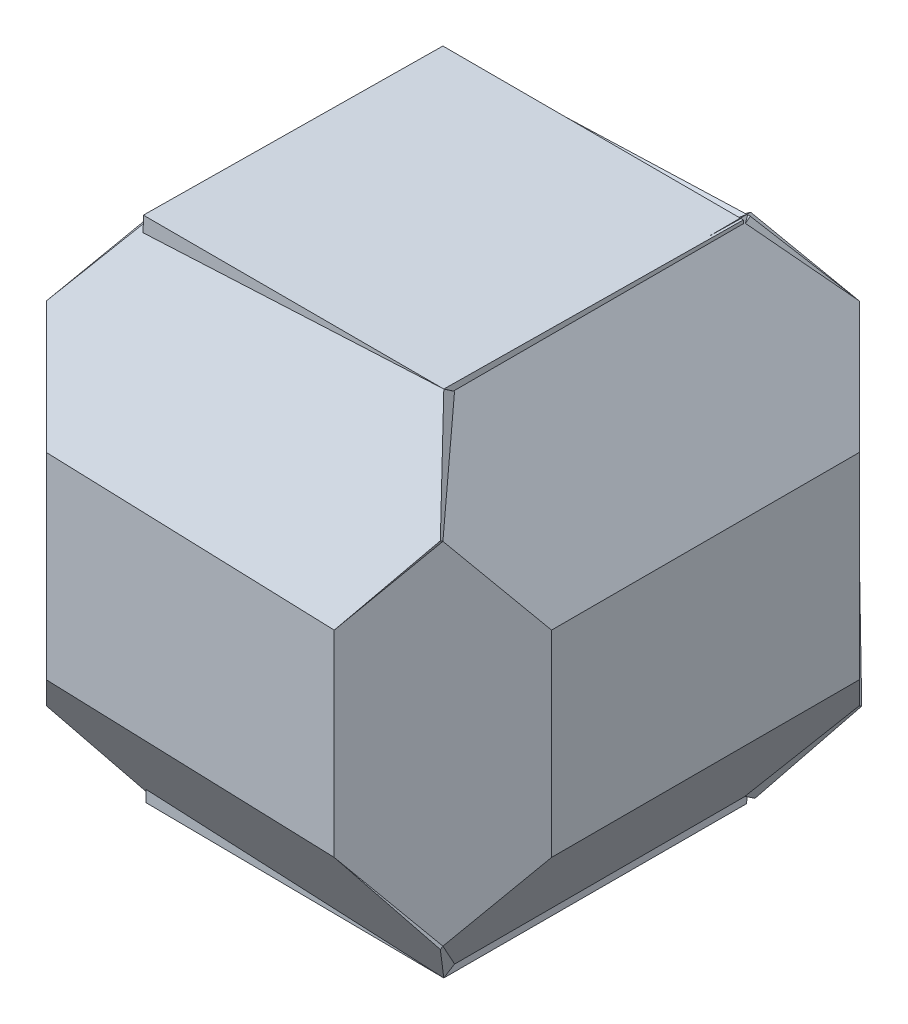
from build123d import *

# Parameters (mm, degrees)
SKETCH1_W            = 50
SKETCH1_H            = 50
BOSS_EXTRUDE1_DEPTH  = 50
BOSS_EXTRUDE2_DEPTH  = 82
BOSS_EXTRUDE3_DEPTH  = 82
SKETCH10_W           = 43.89696962
SKETCH10_H           = 28.079689784
BOSS_EXTRUDE4_DEPTH  = 67
SKETCH11_W           = 41.068542494
SKETCH11_H           = 28.079689784
BOSS_EXTRUDE5_DEPTH  = 69
SKETCH12_W           = 42.506288502
SKETCH12_H           = 28.079689784
BOSS_EXTRUDE6_DEPTH  = 69
SKETCH13_W           = 42.506288502
SKETCH13_H           = 28.079689784
BOSS_EXTRUDE7_DEPTH  = 69
BOSS_EXTRUDE11_DEPTH = 35
BOSS_EXTRUDE12_DEPTH = 20
BOSS_EXTRUDE13_DEPTH = 35
BOSS_EXTRUDE16_DEPTH = 30
BOSS_EXTRUDE17_DEPTH = 30
BOSS_EXTRUDE18_DEPTH = 30
BOSS_EXTRUDE19_DEPTH = 30
BOSS_EXTRUDE20_DEPTH = 30
SKETCH30_W           = 42.854917171
SKETCH30_H           = 42.727525514
BOSS_EXTRUDE21_DEPTH = 40
SKETCH33_W           = 42.490664677
SKETCH33_H           = 43.20817588
BOSS_EXTRUDE23_DEPTH = 40


with BuildPart() as part:
    # Sketch1 → Boss-Extrude1 (new body)
    with BuildSketch(Plane.XY):
        with Locations((25, 25)):
            Rectangle(SKETCH1_W, SKETCH1_H)
    extrude(amount=BOSS_EXTRUDE1_DEPTH)

    # Sketch7 → Boss-Extrude2 (add)
    with BuildSketch(Plane(origin=(-3.284271247, 0, -3.284271247), x_dir=(-0.7071067811865477, 0, 0.7071067811865475), z_dir=(-0.7071067811865475, 0, -0.7071067811865477))):
        Polygon((0, 50), (-10.960155108, 39.039844892), (-10.960155108, 10.960155108), (0, 0), (10.960155108, 10.960155108), (10.960155108, 39.039844892), align=None)
    extrude(amount=-BOSS_EXTRUDE2_DEPTH)

    # Sketch9 → Boss-Extrude3 (add)
    with BuildSketch(Plane(origin=(-28.284271247, 0, 28.284271247), x_dir=(0.7071067811865477, 0, 0.7071067811865475), z_dir=(-0.7071067811865475, 0, 0.7071067811865477))):
        Polygon((46.315494168, 39.039844892), (46.315494168, 10.960155108), (35.355339059, 0), (35.355339059, 50), align=None)
        Polygon((35.355339059, 0), (35.355339059, 25), (24.395183951, 25), (24.395183951, 10.960155108), align=None)
        Polygon((35.355339059, 25), (35.355339059, 50), (24.395183951, 39.039844892), (24.395183951, 25), align=None)
    extrude(amount=-BOSS_EXTRUDE3_DEPTH)

    # Sketch10 → Boss-Extrude4 (add)
    with BuildSketch(Plane(origin=(62.44848481, 0, 0), x_dir=(0, 0, -1), z_dir=(1, 0, 0))):
        with Locations((-25, 25)):
            Rectangle(SKETCH10_W, SKETCH10_H)
    extrude(amount=-BOSS_EXTRUDE4_DEPTH)

    # Sketch11 → Boss-Extrude5 (add)
    with BuildSketch(Plane.ZY.offset(11.034271247)):
        with Locations((25, 25)):
            Rectangle(SKETCH11_W, SKETCH11_H)
    extrude(amount=-BOSS_EXTRUDE5_DEPTH)

    # Sketch12 → Boss-Extrude6 (add)
    with BuildSketch(Plane(origin=(-0.361971288, 0, -10.873561362), x_dir=(0.9994463773330298, 0, -0.03327069034275125), z_dir=(0.03327069034275125, 0, 0.9994463773330298))):
        with Locations((26.083518497, 25)):
            Rectangle(SKETCH12_W, SKETCH12_H)
    extrude(amount=BOSS_EXTRUDE6_DEPTH)

    # Sketch13 → Boss-Extrude7 (add)
    with BuildSketch(Plane(origin=(-2.024584835, 0, 60.81821442), x_dir=(-0.9994463773330297, 0, -0.033270690342753886), z_dir=(0.033270690342753886, 0, -0.9994463773330298))):
        with Locations((-27.747053014, 25)):
            Rectangle(SKETCH13_W, SKETCH13_H)
    extrude(amount=BOSS_EXTRUDE7_DEPTH)

    # Sketch18 → Boss-Extrude11 (add)
    with BuildSketch(Plane(origin=(-1.210472992, -24.856180746, 36.362420912), x_dir=(-0.9996225841221649, 0.015502846079432883, -0.022679309433112364), z_dir=(0.02747160921616073, 0.5641094752488854, -0.8252428797763128))):
        Polygon((-48.177140619, 44.289287441), (-55.918364596, 30.867583479), (2.074581236, 30.069511003), (-5.678344842, 43.491214965), align=None)
        Polygon((-6.044745692, 16.86623375), (-48.549408926, 17.237940115), (-55.918364596, 30.867583479), (2.074581236, 30.069511003), align=None)
    extrude(amount=BOSS_EXTRUDE11_DEPTH)

    # Sketch20 → Boss-Extrude12 (add)
    with BuildSketch(Plane(origin=(-0.076935496, -1.579814353, -2.311130381), x_dir=(0.999622584122165, -0.015502846079431523, -0.022679309433110136), z_dir=(0.02747160921615812, 0.5641094752488899, 0.8252428797763098))):
        Polygon((4.91078022, -11.349889226), (-3.208546707, 1.853388028), (54.784399124, 2.651460504), (47.415443454, -10.97818286), align=None)
        Polygon((54.784399124, 2.651460504), (-3.208546707, 1.853388028), (4.54437937, 15.27509199), (47.043175148, 16.073164466), align=None)
    extrude(amount=BOSS_EXTRUDE12_DEPTH)

    # Sketch21 → Boss-Extrude13 (add)
    with BuildSketch(Plane(origin=(-2.189514165, -1.548220314, 0), x_dir=(0, 0, 1), z_dir=(-0.8164965809277278, -0.5773502691896232, 0))):
        Polygon((4.465728753, 15.319568647), (-3.284271247, 1.896174889), (53.284271247, 1.896174889), (45.534271247, 15.319568647), align=None)
        Polygon((4.465728753, -11.52721887), (-3.284271247, 1.896174889), (53.284271247, 1.896174889), (45.534271247, -11.52721887), align=None)
    extrude(amount=-BOSS_EXTRUDE13_DEPTH)

    # Sketch24 → Boss-Extrude16 (add)
    with BuildSketch(Plane(origin=(36.46565654, -25.78511302, 0), x_dir=(0, 0, -1), z_dir=(0.8164965809277298, -0.5773502691896206, -2.1576539064442646e-15))):
        Polygon((-46.94848481, 45.003578688), (-54.69848481, 31.580184929), (4.69848481, 31.580184929), (-3.05151519, 45.003578688), align=None)
        Polygon((4.69848481, 31.580184929), (-3.05151519, 18.156791171), (-46.94848481, 18.156791171), (-54.69848481, 31.580184929), align=None)
    extrude(amount=-BOSS_EXTRUDE16_DEPTH)

    # Sketch25 → Boss-Extrude17 (add)
    with BuildSketch(Plane(origin=(-0.854698831, 18.759344315, -25.675020321), x_dir=(-0.999638957424367, -0.015851537030512463, 0.021695243102923284), z_dir=(-0.02686921657817079, 0.5897385919181864, -0.8071470983673484))):
        Polygon((-55.57324795, 37.600052322), (-48.20976624, 51.239302196), (-5.705253962, 51.627887027), (2.419255571, 38.434369861), align=None)
        Polygon((2.419255571, 38.434369861), (-5.322349178, 25.012592547), (-47.820448859, 24.178275008), (-55.57324795, 37.600052322), align=None)
    extrude(amount=-BOSS_EXTRUDE17_DEPTH)

    # Sketch26 → Boss-Extrude18 (add)
    with BuildSketch(Plane(origin=(-25.759740205, 18.21488698, 0), x_dir=(0, 0, -1), z_dir=(0.8164965809277274, -0.577350269189624, 0))):
        Polygon((-53.284271247, 38.928654158), (3.284271247, 38.928654158), (-4.465728753, 52.352047916), (-45.534271247, 52.352047916), align=None)
        Polygon((-53.284271247, 38.928654158), (3.284271247, 38.928654158), (-4.465728753, 25.505260399), (-45.534271247, 25.505260399), align=None)
    extrude(amount=BOSS_EXTRUDE18_DEPTH)

    # Sketch27 → Boss-Extrude19 (add)
    with BuildSketch(Plane(origin=(-1.985322745, 40.76715575, 59.638787305), x_dir=(-0.9996225841221649, -0.015502846079433249, -0.022679309433112957), z_dir=(0.027471609216161423, -0.5641094752488844, -0.8252428797763135))):
        Polygon((1.299438932, 11.208211854), (-6.453487146, -2.213492108), (-48.952282923, -3.011564584), (-56.6935069, 10.410139378), align=None)
        Polygon((1.299438932, 11.208211854), (-56.6935069, 10.410139378), (-49.32455123, 24.039782742), (-6.819887996, 24.411489107), align=None)
    extrude(amount=BOSS_EXTRUDE19_DEPTH)

    # Sketch28 → Boss-Extrude20 (add)
    with BuildSketch(Plane(origin=(60.035882579, 42.451779686, 0), x_dir=(0, 0, -1), z_dir=(0.8164965809277244, 0.5773502691896283, -2.4614163880711423e-15))):
        Polygon((-54.69848481, 9.244644117), (4.69848481, 9.244644117), (-3.05151519, -4.178749641), (-46.94848481, -4.178749641), align=None)
        Polygon((4.69848481, 9.244644117), (-3.05151519, 22.668037876), (-46.94848481, 22.668037876), (-54.69848481, 9.244644117), align=None)
    extrude(amount=-BOSS_EXTRUDE20_DEPTH)

    # Sketch30 → Boss-Extrude21 (add)
    with BuildSketch(Plane(origin=(0.075943642, 60.908962317, -0.671814503), x_dir=(0.9999992227922807, -0.0012466859077159748, 1.37507132213969e-05), z_dir=(0.0012467617393117666, 0.9999383999947375, -0.011029134196744814))):
        with Locations((25.817247108, -26.501558145)):
            Rectangle(SKETCH30_W, SKETCH30_H)
    extrude(amount=-BOSS_EXTRUDE21_DEPTH)

    # Sketch33 → Boss-Extrude23 (add)
    with BuildSketch(Plane(origin=(-0.107719644, -10.983382918, 0.016428067), x_dir=(-0.9999519099450446, 0.009807016982304734, -1.4668552494532482e-05), z_dir=(-0.009807027952323055, -0.9999507914113943, 0.0014956465051741195))):
        with Locations((-26.185280863, -25.570085766)):
            Rectangle(SKETCH33_W, SKETCH33_H)
    extrude(amount=-BOSS_EXTRUDE23_DEPTH)


solid = part.part
